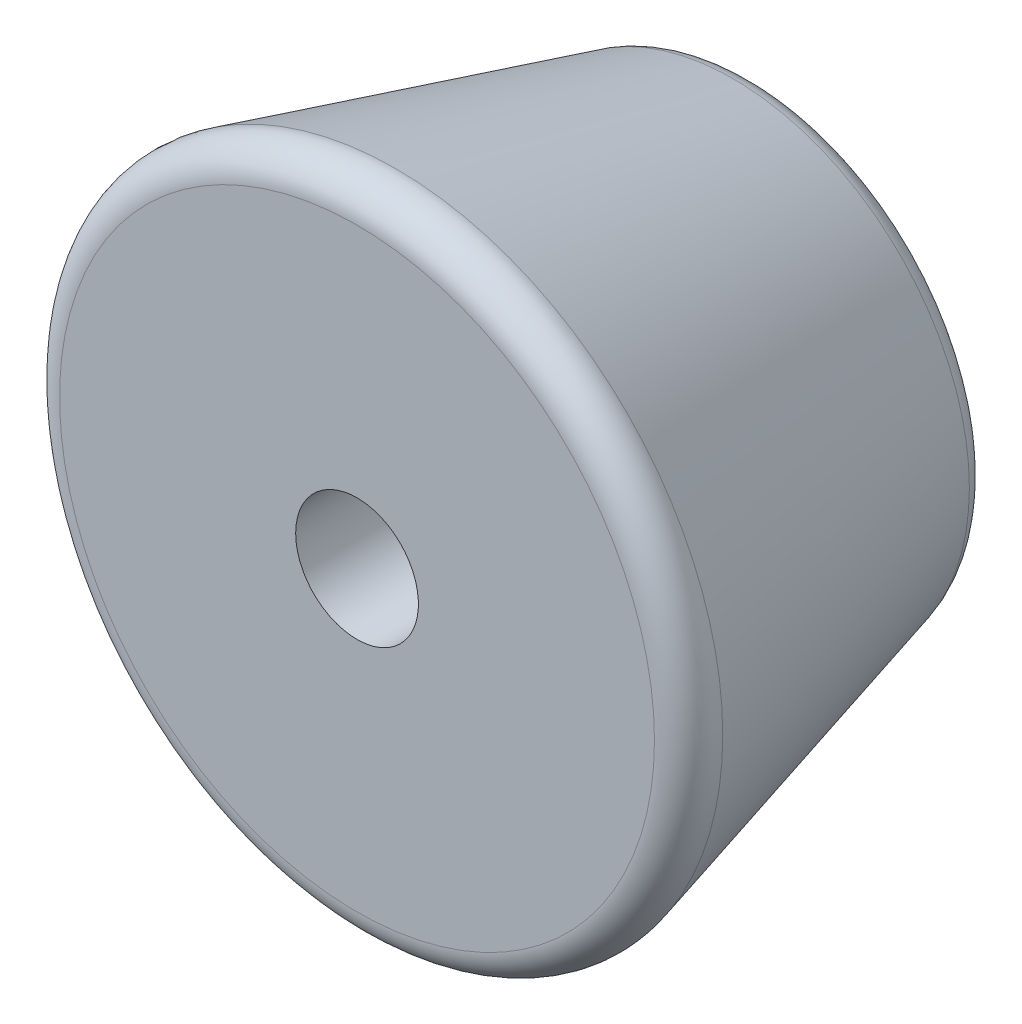
from build123d import *

# Parameters (mm, degrees)
SKETCH2_R          = 5
CUT_EXTRUDE1_DEPTH = 7
SKETCH3_R          = 2
CUT_EXTRUDE2_DEPTH = 18.058722109
FILLET1_R          = 1


with BuildPart() as part:
    # Sketch1 → Revolve1 (revolve)
    with BuildSketch(Plane(origin=(0, 0, 0), x_dir=(1, 0, 0), z_dir=(0, 1, 0))):
        Polygon((0, 0), (0, 13), (7.5, 13), (11, 0), align=None)
    revolve(axis=Axis((0, 0, 0), (0, 0, -1)))

    # Sketch2 → Cut-Extrude1 (cut)
    with BuildSketch(Plane(origin=(0, 0, -13), x_dir=(-1, 0, 0), z_dir=(0, 0, -1))):
        Circle(SKETCH2_R)
    extrude(amount=-CUT_EXTRUDE1_DEPTH, mode=Mode.SUBTRACT)

    # Sketch3 → Cut-Extrude2 (cut, through all)
    with BuildSketch(Plane(origin=(0, 0, -6), x_dir=(-1, 0, 0), z_dir=(0, 0, -1))):
        Circle(SKETCH3_R)
    extrude(amount=-CUT_EXTRUDE2_DEPTH, mode=Mode.SUBTRACT)

    # Fillet1
    fillet1_edges = [part.edges().sort_by_distance(p)[0] for p in [
        (5, 0, -13),
        (-11, 0, 0),
        (-7.5, 0, -13),
    ]]
    fillet(fillet1_edges, radius=FILLET1_R)


solid = part.part
